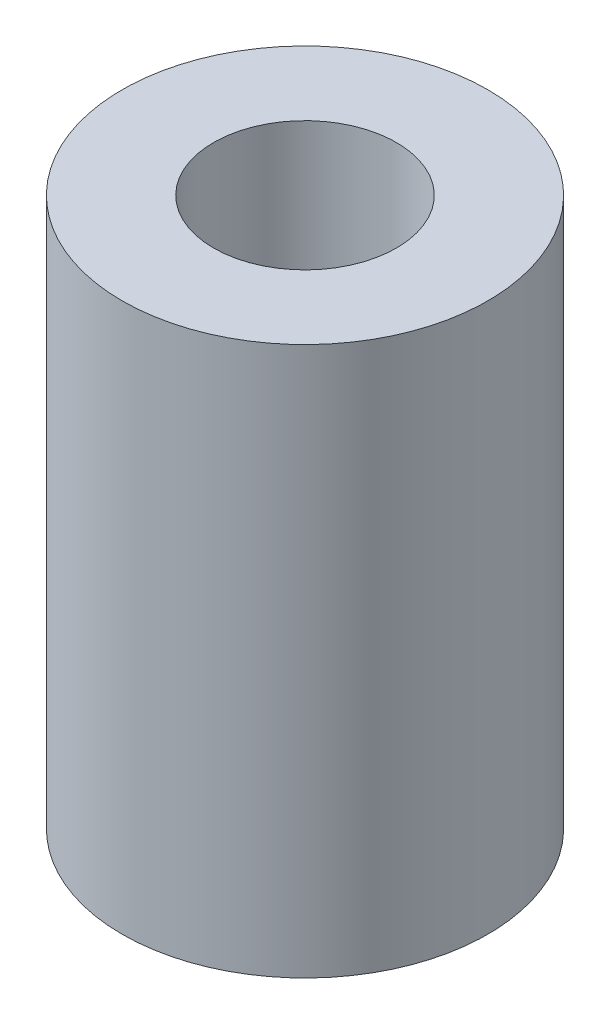
from build123d import *

# Parameters (mm, degrees)
SKETCH1_R               = 6.35
BOSS_EXTRUDE1_DEPTH     = 19.05
CUT_EXTRUDE1_DEPTH      = 22.060567419
CUT_EXTRUDE1_DEPTH_BACK = 22.060567419
SKETCH2_R               = 3.175


with BuildPart() as part:
    # Sketch1 → Boss-Extrude1 (new body)
    with BuildSketch(Plane(origin=(0, 0, 0), x_dir=(1, 0, 0), z_dir=(0, 1, 0))):
        with Locations(Location((0, 0, 0), (0, 0, 90))):
            Circle(SKETCH1_R)
    extrude(amount=BOSS_EXTRUDE1_DEPTH)

    # Sketch2 → Cut-Extrude1 (cut, two sides: drawn at the far end of the back side and taken through both)
    with BuildSketch(Plane(origin=(0, 19.05, 0), x_dir=(1, 0, 0), z_dir=(0, 1, 0)).offset(-CUT_EXTRUDE1_DEPTH_BACK)):
        with Locations(Location((0, 0, 0), (0, 0, 270))):
            Circle(SKETCH2_R)
    extrude(amount=CUT_EXTRUDE1_DEPTH + CUT_EXTRUDE1_DEPTH_BACK, mode=Mode.SUBTRACT)


solid = part.part
